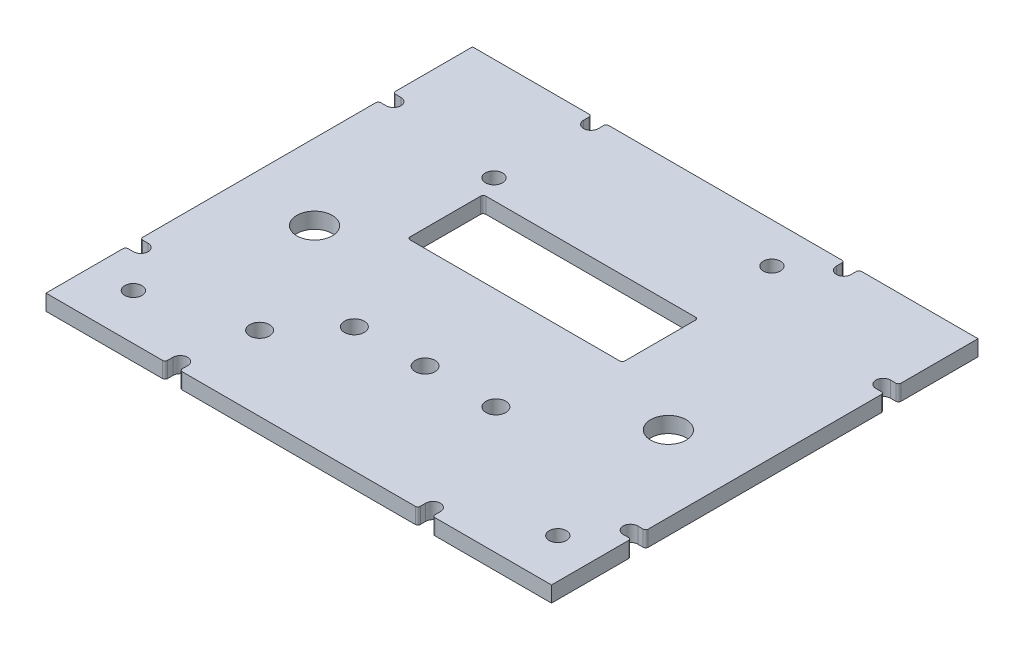
from build123d import *

# Parameters (mm, degrees)
SKETCH1_W                       = 101.6
SKETCH1_H                       = 85.725
BOSS_EXTRUDE1_DEPTH             = 3.175
F_29_0_136_DIAMETER_HOLE1_D     = 3.4544
F_9_32_0_28125_DIAMETER_HOLE1_D = 7.14375
F_5_32_0_15625_DIAMETER_HOLE1_D = 3.96875
SKETCH8_W                       = 43.18
SKETCH8_H                       = 15.24
CUT_EXTRUDE1_DEPTH              = 67.542576831
CUT_EXTRUDE2_DEPTH              = 67.542576831
FILLET1_R                       = 0.508
CUT_EXTRUDE3_DEPTH              = 67.542576831
FILLET2_R                       = 0.508


with BuildPart() as part:
    # Sketch1 → Boss-Extrude1 (new body)
    with BuildSketch(Plane(origin=(0, 0, 0), x_dir=(1, 0, 0), z_dir=(0, 1, 0))):
        Rectangle(SKETCH1_W, SKETCH1_H)
    extrude(amount=BOSS_EXTRUDE1_DEPTH)

    # #29 (0.136) Diameter Hole1 (through all)
    with Locations(Plane(origin=(0, 3.175, 0), x_dir=(1, 0, 0), z_dir=(0, 1, 0))):
        with Locations((-25.8318, 22.2123), (17.4498, 34.7853), (42.8498, -33.6423), (-42.4688, -33.6423)):
            Hole(F_29_0_136_DIAMETER_HOLE1_D / 2)

    # 9/32 (0.28125) Diameter Hole1 (through all)
    with Locations(Plane(origin=(0, 3.175, 0), x_dir=(1, 0, 0), z_dir=(0, 1, 0))):
        with Locations((-35.56, -4.1275), (35.56, -4.1275)):
            Hole(F_9_32_0_28125_DIAMETER_HOLE1_D / 2)

    # 5/32 (0.15625) Diameter Hole1 (through all)
    with Locations(Plane(origin=(0, 3.175, 0), x_dir=(1, 0, 0), z_dir=(0, 1, 0))):
        with Locations((-22.86, -27.8765), (-13.942192497, -17.744307503), (0, -17.4625), (14.224, -17.4625)):
            Hole(F_5_32_0_15625_DIAMETER_HOLE1_D / 2)

    # Sketch8 → Cut-Extrude1 (cut, through all)
    with BuildSketch(Plane(origin=(0, 3.175, 0), x_dir=(1, 0, 0), z_dir=(0, 1, 0))):
        with Locations((-2.413, 10.6045)):
            Rectangle(SKETCH8_W, SKETCH8_H)
    extrude(amount=-CUT_EXTRUDE1_DEPTH, mode=Mode.SUBTRACT)

    # Sketch9 → Cut-Extrude2 (cut, through all)
    with BuildSketch(Plane(origin=(0, 3.175, 0), x_dir=(1, 0, 0), z_dir=(0, 1, 0))):
        with BuildLine():
            Line((-49.2125, 26.8732), (-50.8, 26.8732))
            Line((-50.8, 26.8732), (-50.8, 23.9268))
            Line((-50.8, 23.9268), (-49.2125, 23.9268))
            ThreePointArc((-49.2125, 23.9268), (-47.7393, 25.4), (-49.2125, 26.8732))
        make_face()
        with BuildLine():
            Line((-49.2125, -23.9268), (-50.8, -23.9268))
            Line((-50.8, -23.9268), (-50.8, -26.8732))
            Line((-50.8, -26.8732), (-49.2125, -26.8732))
            ThreePointArc((-49.2125, -26.8732), (-47.7393, -25.4), (-49.2125, -23.9268))
        make_face()
        with BuildLine():
            Line((49.2125, -26.8732), (50.8, -26.8732))
            Line((50.8, -26.8732), (50.8, -23.9268))
            Line((50.8, -23.9268), (49.2125, -23.9268))
            ThreePointArc((49.2125, -23.9268), (47.7393, -25.4), (49.2125, -26.8732))
        make_face()
        with BuildLine():
            Line((50.8, 26.8732), (50.8, 23.9268))
            Line((50.8, 23.9268), (49.2125, 23.9268))
            ThreePointArc((49.2125, 23.9268), (47.7393, 25.4), (49.2125, 26.8732))
            Line((49.2125, 26.8732), (50.8, 26.8732))
        make_face()
    extrude(amount=-CUT_EXTRUDE2_DEPTH, mode=Mode.SUBTRACT)

    # Fillet1
    fillet1_edges = [part.edges().sort_by_distance(p)[0] for p in [
        (-50.8, 1.5875, -26.8732),
        (-50.8, 1.5875, 26.8732),
        (-50.8, 1.5875, 23.9268),
        (50.8, 1.5875, 23.9268),
        (50.8, 1.5875, 26.8732),
        (50.8, 1.5875, -26.8732),
        (50.8, 1.5875, -23.9268),
        (-24.003, 1.5875, -2.9845),
        (-24.003, 1.5875, -18.2245),
        (19.177, 1.5875, -18.2245),
        (19.177, 1.5875, -2.9845),
        (-50.8, 1.5875, -23.9268),
    ]]
    fillet(fillet1_edges, radius=FILLET1_R)

    # Sketch10 → Cut-Extrude3 (cut, through all)
    with BuildSketch(Plane(origin=(0, 3.175, 0), x_dir=(1, 0, 0), z_dir=(0, 1, 0))):
        with BuildLine():
            Line((-23.9268, 41.275), (-23.9268, 42.8625))
            Line((-23.9268, 42.8625), (-26.8732, 42.8625))
            Line((-26.8732, 42.8625), (-26.8732, 41.275))
            ThreePointArc((-26.8732, 41.275), (-25.4, 39.8018), (-23.9268, 41.275))
        make_face()
        with BuildLine():
            Line((26.8732, -41.275), (26.8732, -42.8625))
            Line((26.8732, -42.8625), (23.9268, -42.8625))
            Line((23.9268, -42.8625), (23.9268, -41.275))
            ThreePointArc((23.9268, -41.275), (25.4, -39.8018), (26.8732, -41.275))
        make_face()
        with BuildLine():
            Line((-23.9268, -41.275), (-23.9268, -42.8625))
            Line((-23.9268, -42.8625), (-26.8732, -42.8625))
            Line((-26.8732, -42.8625), (-26.8732, -41.275))
            ThreePointArc((-26.8732, -41.275), (-25.4, -39.8018), (-23.9268, -41.275))
        make_face()
        with BuildLine():
            Line((26.8732, 42.8625), (23.9268, 42.8625))
            Line((23.9268, 42.8625), (23.9268, 41.275))
            ThreePointArc((23.9268, 41.275), (25.4, 39.8018), (26.8732, 41.275))
            Line((26.8732, 41.275), (26.8732, 42.8625))
        make_face()
    extrude(amount=-CUT_EXTRUDE3_DEPTH, mode=Mode.SUBTRACT)

    # Fillet2
    fillet2_edges = [part.edges().sort_by_distance(p)[0] for p in [
        (-26.8732, 1.5875, -42.8625),
        (-23.9268, 1.5875, -42.8625),
        (26.8732, 1.5875, -42.8625),
        (23.9268, 1.5875, -42.8625),
        (-23.9268, 1.5875, 42.8625),
        (-26.8732, 1.5875, 42.8625),
        (26.8732, 1.5875, 42.8625),
        (23.9268, 1.5875, 42.8625),
    ]]
    fillet(fillet2_edges, radius=FILLET2_R)


solid = part.part
